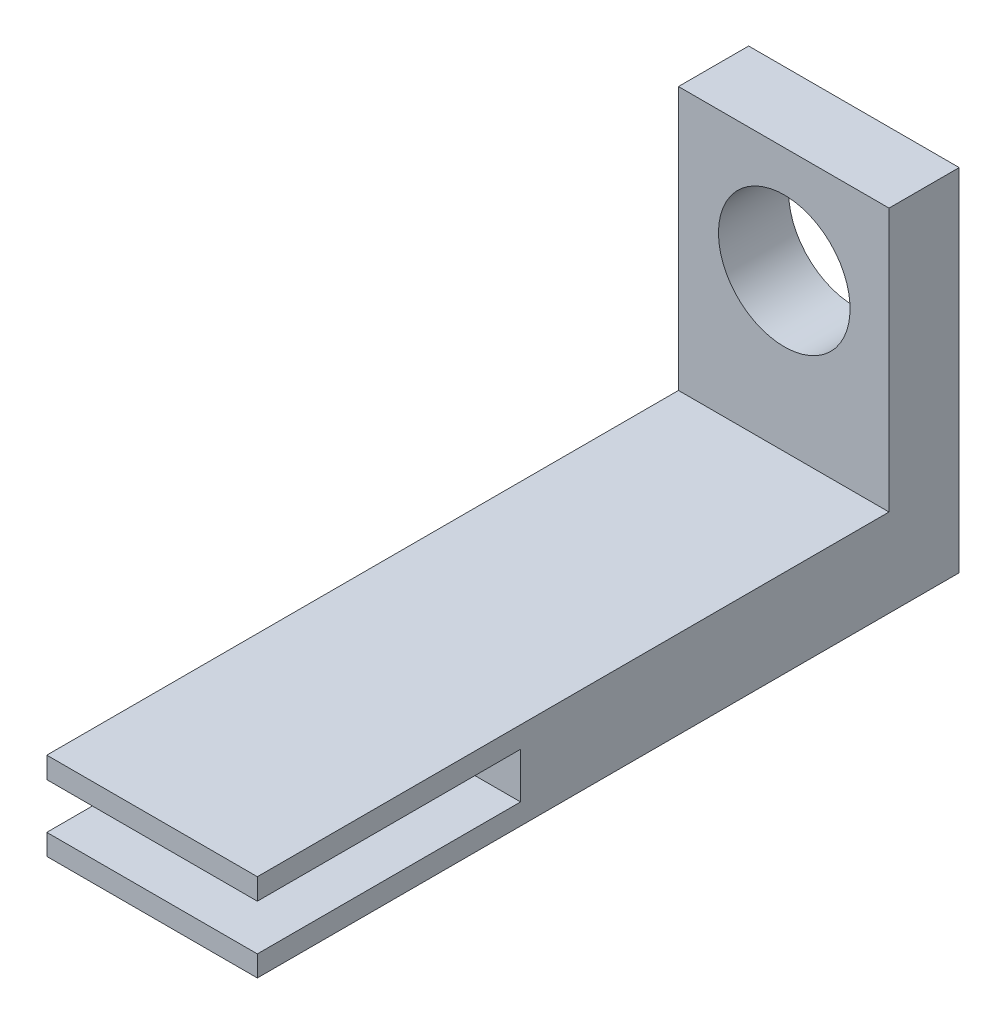
from build123d import *

# Parameters (mm, degrees)
SKETCH2_W           = 12
SKETCH2_H           = 40
BOSS_EXTRUDE1_DEPTH = 5
SKETCH3_W           = 12.004104261
SKETCH3_H           = 2.6
CUT_EXTRUDE1_DEPTH  = 15
SKETCH4_W           = 12
SKETCH4_H           = 4
BOSS_EXTRUDE2_DEPTH = 15
SKETCH5_R           = 3.75
CUT_EXTRUDE2_DEPTH  = 15


with BuildPart() as part:
    # Sketch2 → Boss-Extrude1 (new body)
    with BuildSketch(Plane(origin=(0, 0, 0), x_dir=(1, 0, 0), z_dir=(0, 1, 0))):
        with Locations((-9.764705882, 23.058823529)):
            Rectangle(SKETCH2_W, SKETCH2_H)
    extrude(amount=BOSS_EXTRUDE1_DEPTH)

    # Sketch3 → Cut-Extrude1 (cut)
    with BuildSketch(Plane.XY.offset(-3.058823529)):
        with Locations((-9.766758013, 2.489565118)):
            Rectangle(SKETCH3_W, SKETCH3_H)
    extrude(amount=-CUT_EXTRUDE1_DEPTH, mode=Mode.SUBTRACT)

    # Sketch4 → Boss-Extrude2 (add)
    with BuildSketch(Plane(origin=(0, 5, 0), x_dir=(1, 0, 0), z_dir=(0, 1, 0))):
        with Locations((-9.764705882, 41.058823529)):
            Rectangle(SKETCH4_W, SKETCH4_H)
    extrude(amount=BOSS_EXTRUDE2_DEPTH)

    # Sketch5 → Cut-Extrude2 (cut)
    with BuildSketch(Plane(origin=(0, 0, -43.058823529), x_dir=(-1, 0, 0), z_dir=(0, 0, -1))):
        with Locations((9.734798195, 13.917907096)):
            Circle(SKETCH5_R)
    extrude(amount=-CUT_EXTRUDE2_DEPTH, mode=Mode.SUBTRACT)


solid = part.part
